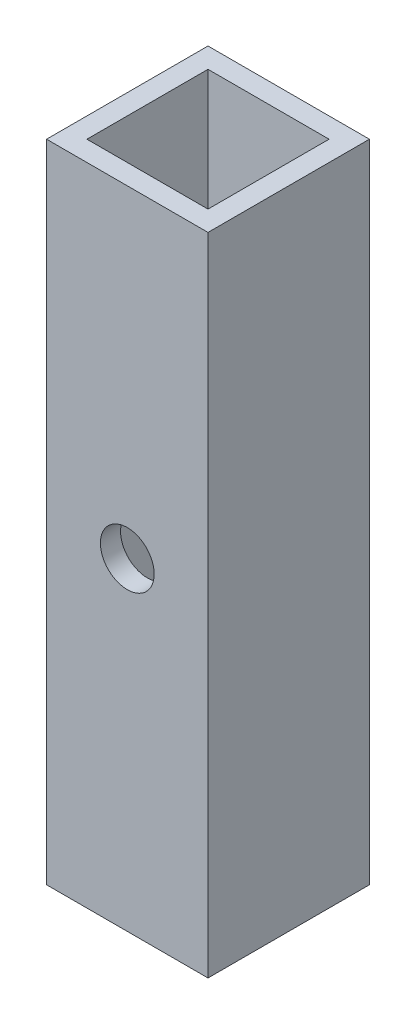
from build123d import *

# Parameters (mm, degrees)
SKETCH1_W                  = 38.1
SKETCH1_H                  = 38.1
SKETCH1_W_2                = 28.575
SKETCH1_H_2                = 28.575
BOSS_EXTRUDE1_DEPTH        = 152.4
F_1_2_0_5_DIAMETER_HOLE1_D = 12.7


with BuildPart() as part:
    # Sketch1 → Boss-Extrude1 (new body)
    with BuildSketch(Plane(origin=(0, 0, 0), x_dir=(1, 0, 0), z_dir=(0, 1, 0))):
        with Locations((19.05, 19.05)):
            Rectangle(SKETCH1_W, SKETCH1_H)
        with Locations((19.05, 19.05)):
            Rectangle(SKETCH1_W_2, SKETCH1_H_2, mode=Mode.SUBTRACT)
    extrude(amount=BOSS_EXTRUDE1_DEPTH)

    # 1/2 (0.5) Diameter Hole1 (through all)
    with Locations(Plane.XY):
        with Locations((19.05, 76.2)):
            Hole(F_1_2_0_5_DIAMETER_HOLE1_D / 2)


solid = part.part
